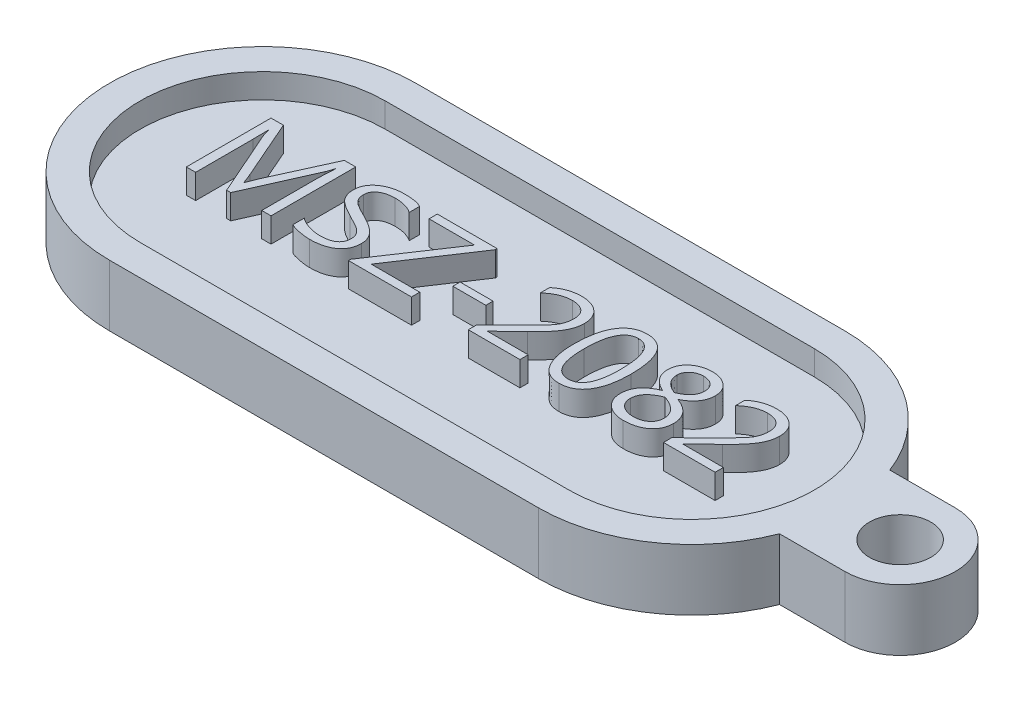
from build123d import *

# Parameters (mm, degrees)
EXTRUDE_1_DEPTH     = 5
CUT_EXTRUDE_1_DEPTH = 2
SKETCH_3_W          = 2.695980479
SKETCH_3_H          = 0.58974573
EXTRUDE_2_DEPTH     = 2
EXTRUDE_START       = -5
EXTRUDE_3_DEPTH     = 5
SKETCH_5_R          = 2.5
CUT_EXTRUDE_2_DEPTH = 59.081838814


with BuildPart() as part:
    # 草圖1 → 填料-伸長1 (new body)
    with BuildSketch(Plane(origin=(0, 0, 0), x_dir=(1, 0, 0), z_dir=(0, 1, 0))):
        with BuildLine():
            Line((0, 12.5), (35, 12.5))
            ThreePointArc((35, 12.5), (47.5, 0), (35, -12.5))
            Line((35, -12.5), (0, -12.5))
            ThreePointArc((0, -12.5), (-12.5, 0), (0, 12.5))
        make_face()
    extrude(amount=EXTRUDE_1_DEPTH)

    # 草圖2 → 除料-伸長1 (cut)
    with BuildSketch(Plane(origin=(0, 5, 0), x_dir=(1, 0, 0), z_dir=(0, 1, 0))):
        with BuildLine():
            Line((0, -10), (35, -10))
            ThreePointArc((35, -10), (45, 0), (35, 10))
            Line((35, 10), (0, 10))
            ThreePointArc((0, 10), (-10, 0), (0, -10))
        make_face()
    extrude(amount=-CUT_EXTRUDE_1_DEPTH, mode=Mode.SUBTRACT)

    # 草圖3 → 填料-伸長2 (add)
    # profile 1 of 8: a face of its own
    with BuildSketch(Plane(origin=(0, 3, 0), x_dir=(1, 0, 0), z_dir=(0, 1, 0))):
        with BuildLine():
            Line((2.704832855, -2.780069862), (2.704832855, 1.872076141))
            add(Edge.make_bspline(
                [(2.704832855, 1.872076141), (2.705451639, 1.965999263), (2.706765046, 2.165356947), (2.723785134, 2.480790019), (2.743165459, 2.830305206), (2.764660012, 3.073997432), (2.775918278, 3.201636826)],
                knots=[0, 0, 0, 0, 0.846147317, 1.796000454, 2.84560467, 4, 4, 4, 4], degree=3))
            Line((2.775918278, 3.201636826), (2.753539533, 3.201636826))
            add(Edge.make_bspline(
                [(2.753539533, 3.201636826), (2.743548192, 3.162557397), (2.724433888, 3.087795049), (2.695364265, 2.980746478), (2.667741197, 2.884326632), (2.643027552, 2.797522421), (2.61821862, 2.721623614), (2.594038471, 2.656147594), (2.574112113, 2.59996911), (2.558103903, 2.567457612), (2.550814439, 2.552653244)],
                knots=[0, 0, 0, 0, 1.421882079, 2.720184076, 3.910017078, 4.957512784, 5.901570106, 6.723562071, 7.418763907, 8, 8, 8, 8], degree=3))
            Line((2.550814439, 2.552653244), (0.177351155, -2.780069862))
            Line((0.177351155, -2.780069862), (-0.159646405, -2.780069862))
            Line((-0.159646405, -2.780069862), (-2.49230139, 2.517110533))
            add(Edge.make_bspline(
                [(-2.49230139, 2.517110533), (-2.50825019, 2.557274827), (-2.54418821, 2.647778515), (-2.588979084, 2.803459806), (-2.640055609, 2.990926929), (-2.670624846, 3.127763543), (-2.687128104, 3.201636826)],
                knots=[0, 0, 0, 0, 0.727425743, 1.639135316, 2.725452061, 4, 4, 4, 4], degree=3))
            Line((-2.687128104, 3.201636826), (-2.709506848, 3.201636826))
            add(Edge.make_bspline(
                [(-2.709506848, 3.201636826), (-2.707602274, 3.168294632), (-2.703444151, 3.095500933), (-2.700155861, 2.976973523), (-2.696102588, 2.840074234), (-2.691929763, 2.684750326), (-2.689389282, 2.510974986), (-2.688549315, 2.318772944), (-2.686721628, 2.108152676), (-2.686988879, 1.961591581), (-2.687128104, 1.885240108)],
                knots=[0, 0, 0, 0, 0.60868432, 1.328898202, 2.161029372, 3.105090589, 4.160939104, 5.328664916, 6.608359414, 8, 8, 8, 8], degree=3))
            Line((-2.687128104, 1.885240108), (-2.687128104, -2.780069862))
            Line((-2.687128104, -2.780069862), (-3.445372614, -2.780069862))
            Line((-3.445372614, -2.780069862), (-3.445372614, 4.128380116))
            Line((-3.445372614, 4.128380116), (-2.434379934, 4.128380116))
            Line((-2.434379934, 4.128380116), (-0.325512391, -0.705428634))
            add(Edge.make_bspline(
                [(-0.325512391, -0.705428634), (-0.305626123, -0.751443296), (-0.267635571, -0.839349306), (-0.215081222, -0.967013978), (-0.166046613, -1.083239568), (-0.123799868, -1.189851588), (-0.088451579, -1.286199501), (-0.057725404, -1.372060849), (-0.032974569, -1.447644981), (-0.018717188, -1.49480479), (-0.012209972, -1.516329012)],
                knots=[0, 0, 0, 0, 1.38306647, 2.642198107, 3.809130388, 4.863555133, 5.805883861, 6.640654924, 7.379580902, 8, 8, 8, 8], degree=3))
            Line((-0.012209972, -1.516329012), (0.018067152, -1.516329012))
            add(Edge.make_bspline(
                [(0.018067152, -1.516329012), (0.041750654, -1.454015814), (0.090997837, -1.324442509), (0.167894714, -1.122814833), (0.255854295, -0.90795433), (0.31686144, -0.759827269), (0.348482729, -0.68304989)],
                knots=[0, 0, 0, 0, 0.892353374, 1.855548705, 2.888485675, 4, 4, 4, 4], degree=3))
            Line((0.348482729, -0.68304989), (2.536334075, 4.128380116))
            Line((2.536334075, 4.128380116), (3.463077365, 4.128380116))
            Line((3.463077365, 4.128380116), (3.463077365, -2.780069862))
            Line((3.463077365, -2.780069862), (2.704832855, -2.780069862))
        make_face()
    # profile 2 of 8: a face of its own
    with BuildSketch(Plane(origin=(0, 3, 0), x_dir=(1, 0, 0), z_dir=(0, 1, 0))):
        with BuildLine():
            add(Edge.make_bspline(
                [(4.979566384, -1.579516055), (5.032529554, -1.622614836), (5.143704009, -1.713083054), (5.340299648, -1.826436339), (5.568212806, -1.927895513), (5.82030915, -2.019113408), (6.083293989, -2.092848961), (6.342422878, -2.149347552), (6.591641344, -2.184030963), (6.754845512, -2.188262331), (6.83436936, -2.190324132)],
                knots=[0, 0, 0, 0, 0.824008304, 1.729667534, 2.73099571, 3.836262011, 4.96582997, 6.028606668, 7.039406984, 8, 8, 8, 8], degree=3))
            add(Edge.make_bspline(
                [(6.83436936, -2.190324132), (6.8953909, -2.189736529), (7.014075834, -2.188593659), (7.185860868, -2.174930974), (7.34646827, -2.1545396), (7.494693104, -2.124420276), (7.63119688, -2.086376829), (7.756059827, -2.040272332), (7.869680253, -1.985803524), (7.970413396, -1.920068697), (8.060705221, -1.848408541), (8.137990557, -1.766435703), (8.204437369, -1.677224159), (8.257099116, -1.577847814), (8.299967064, -1.471321333), (8.327856885, -1.355075861), (8.347494037, -1.231340197), (8.348847672, -1.145627891), (8.349541983, -1.101664046)],
                knots=[0, 0, 0, 0, 1.378837507, 2.68179467, 3.892243878, 5.035886482, 6.097092991, 7.091851668, 8.041023624, 8.937820652, 9.805180856, 10.639951348, 11.47701622, 12.311256343, 13.174980277, 14.064951597, 15.007468453, 16, 16, 16, 16], degree=3))
            add(Edge.make_bspline(
                [(8.349541983, -1.101664046), (8.348093889, -1.051898187), (8.345245954, -0.954024745), (8.313174955, -0.812398618), (8.264962354, -0.678140873), (8.193463361, -0.554555557), (8.107376005, -0.438762487), (8.008448371, -0.329804331), (7.894061136, -0.2312081), (7.786942106, -0.154622415), (7.688066517, -0.092639499), (7.596566821, -0.038568932), (7.48934593, 0.02260629), (7.366153603, 0.092088426), (7.225910995, 0.165844897), (7.069790077, 0.24806949), (6.8979, 0.337387804), (6.777374214, 0.398684578), (6.714577259, 0.430621734)],
                knots=[0, 0, 0, 0, 1.005537763, 1.977569412, 2.924568116, 3.882992817, 4.854659216, 5.841629658, 6.855098546, 7.905112895, 8.503876225, 9.216726976, 10.056161678, 11.002493774, 12.079249954, 13.263129519, 14.574021882, 16, 16, 16, 16], degree=3))
            add(Edge.make_bspline(
                [(6.714577259, 0.430621734), (6.624404727, 0.477154951), (6.451324248, 0.566472523), (6.206148463, 0.701428522), (5.987686618, 0.833061597), (5.794518411, 0.958840712), (5.627856305, 1.0813846), (5.486644714, 1.19917131), (5.370835322, 1.312019266), (5.279436364, 1.422516105), (5.209206356, 1.53439335), (5.146270458, 1.645634348), (5.095540149, 1.762011205), (5.052794116, 1.881083006), (5.020239504, 2.003556386), (4.995887032, 2.129266529), (4.983241338, 2.258838814), (4.980801841, 2.346394722), (4.979566384, 2.390736448)],
                knots=[0, 0, 0, 0, 1.748414335, 3.355970886, 4.821224117, 6.142369616, 7.326440033, 8.383586825, 9.308522186, 10.10915601, 10.847379431, 11.58175963, 12.309532287, 13.031745884, 13.759871933, 14.490936277, 15.235751281, 16, 16, 16, 16], degree=3))
            add(Edge.make_bspline(
                [(4.979566384, 2.390736448), (4.981492437, 2.458438391), (4.98525418, 2.590665947), (5.017610799, 2.78395067), (5.071589438, 2.966553738), (5.147453903, 3.138648115), (5.242685038, 3.301187095), (5.361173043, 3.452262327), (5.501855437, 3.591523804), (5.660955551, 3.72050301), (5.836951348, 3.834770409), (6.024404218, 3.937188104), (6.223819828, 4.022451121), (6.43386433, 4.092315817), (6.6544515, 4.14633827), (6.88601506, 4.183796092), (7.128273935, 4.208402471), (7.293729819, 4.211202629), (7.378041205, 4.212629506)],
                knots=[0, 0, 0, 0, 0.964116894, 1.883000909, 2.78306003, 3.670523563, 4.556201476, 5.460420138, 6.397646791, 7.37114434, 8.37342726, 9.383344475, 10.411158771, 11.459010025, 12.534111432, 13.643144605, 14.799016748, 16, 16, 16, 16], degree=3))
            add(Edge.make_bspline(
                [(7.378041205, 4.212629506), (7.46187515, 4.212082158), (7.623074272, 4.211029696), (7.855341934, 4.197200022), (8.06859056, 4.177384096), (8.262732866, 4.146768899), (8.438622117, 4.109692963), (8.595170777, 4.062199766), (8.734342094, 4.008426389), (8.816035149, 3.961312728), (8.855038323, 3.938818989)],
                knots=[0, 0, 0, 0, 1.324287661, 2.546391074, 3.674934663, 4.706423643, 5.650121807, 6.512024037, 7.289587278, 8, 8, 8, 8], degree=3))
            Line((8.855038323, 3.938818989), (8.855038323, 3.096325089))
            add(Edge.make_bspline(
                [(8.855038323, 3.096325089), (8.802192473, 3.132132287), (8.695681601, 3.204301735), (8.521720143, 3.292502618), (8.338573241, 3.36968517), (8.143606497, 3.431119246), (7.937820139, 3.480273742), (7.720275184, 3.51337726), (7.491709605, 3.535500154), (7.335532909, 3.537573462), (7.25561631, 3.538634386)],
                knots=[0, 0, 0, 0, 0.907651851, 1.829373358, 2.769941643, 3.733712044, 4.734932567, 5.778044283, 6.863011283, 8, 8, 8, 8], degree=3))
            add(Edge.make_bspline(
                [(7.25561631, 3.538634386), (7.20118107, 3.537981932), (7.094336769, 3.536701308), (6.938185969, 3.523580713), (6.789717894, 3.500758913), (6.648735783, 3.471128534), (6.515234051, 3.431760151), (6.389766829, 3.38234173), (6.271014377, 3.326638051), (6.161720044, 3.260760537), (6.063037752, 3.187052895), (5.974939234, 3.10726599), (5.902131557, 3.018040449), (5.842635602, 2.922221739), (5.793913712, 2.820279514), (5.761821173, 2.709990375), (5.741252112, 2.592916607), (5.738978069, 2.512375258), (5.737810894, 2.471036648)],
                knots=[0, 0, 0, 0, 1.255838427, 2.464932264, 3.611894489, 4.71998994, 5.786748334, 6.818978088, 7.828869626, 8.809927634, 9.757607944, 10.667542292, 11.545190788, 12.404842496, 13.265447651, 14.143096147, 15.046926519, 16, 16, 16, 16], degree=3))
            add(Edge.make_bspline(
                [(5.737810894, 2.471036648), (5.739413578, 2.420421022), (5.742533096, 2.321901081), (5.771680582, 2.179549584), (5.815330001, 2.046095125), (5.881491565, 1.924203687), (5.96287461, 1.81258058), (6.055288078, 1.706880391), (6.163319811, 1.611861546), (6.262523378, 1.534871066), (6.357002859, 1.476929201), (6.442546398, 1.425567262), (6.542594865, 1.367253469), (6.65811948, 1.305040244), (6.788195945, 1.235665762), (6.933290897, 1.161610943), (7.093408441, 1.080778861), (7.205112148, 1.025548603), (7.263514691, 0.996672323)],
                knots=[0, 0, 0, 0, 1.075811074, 2.093994519, 3.080249834, 4.053557108, 5.030485713, 6.016077761, 7.034261206, 8.087548715, 8.683401521, 9.39121351, 10.211222501, 11.147220493, 12.183146766, 13.348290249, 14.613594874, 16, 16, 16, 16], degree=3))
            add(Edge.make_bspline(
                [(7.263514691, 0.996672323), (7.345858779, 0.955986372), (7.505665184, 0.877026538), (7.732868637, 0.753224487), (7.941831784, 0.630941749), (8.131151726, 0.508865866), (8.301474294, 0.3880156), (8.452473554, 0.267900771), (8.584950455, 0.148760048), (8.697478, 0.027639412), (8.795471277, -0.093301033), (8.878472756, -0.217922352), (8.95017933, -0.345010314), (9.007247569, -0.477158678), (9.05131113, -0.612162021), (9.085701398, -0.750485317), (9.103533036, -0.892762324), (9.106363462, -0.9888509), (9.107786493, -1.037160607)],
                knots=[0, 0, 0, 0, 1.5164989, 2.943092106, 4.271507486, 5.513568999, 6.661617855, 7.718521642, 8.698192595, 9.600449361, 10.445746346, 11.265663643, 12.070066717, 12.852132382, 13.63804855, 14.413067372, 15.202150218, 16, 16, 16, 16], degree=3))
            add(Edge.make_bspline(
                [(9.107786493, -1.037160607), (9.105622796, -1.10790009), (9.101397611, -1.246037428), (9.072538898, -1.447544311), (9.022771667, -1.636262192), (8.952211938, -1.812813146), (8.860967611, -1.976080134), (8.75063945, -2.128214232), (8.619461528, -2.266879619), (8.468373418, -2.39148318), (8.301022546, -2.504423796), (8.115281538, -2.599025264), (7.915987753, -2.683935488), (7.698572844, -2.747712096), (7.46670081, -2.801347199), (7.21789451, -2.837043763), (6.953710767, -2.85981062), (6.772109876, -2.862791481), (6.679034548, -2.864319252)],
                knots=[0, 0, 0, 0, 0.987904774, 1.929142407, 2.835931655, 3.707665413, 4.577328643, 5.441533139, 6.325949271, 7.235385481, 8.171942798, 9.13956573, 10.142281647, 11.193027883, 12.299148792, 13.464014025, 14.700239157, 16, 16, 16, 16], degree=3))
            add(Edge.make_bspline(
                [(6.679034548, -2.864319252), (6.616241925, -2.862898201), (6.481615964, -2.859851499), (6.266541413, -2.837855959), (6.024868524, -2.806958293), (5.810024262, -2.769730976), (5.634927184, -2.733678136), (5.509887844, -2.706723302), (5.396504576, -2.676042921), (5.292469496, -2.646256849), (5.199339084, -2.613545113), (5.116675036, -2.578965194), (5.042973668, -2.545920609), (4.999941452, -2.519003952), (4.979566384, -2.506259345)],
                knots=[0, 0, 0, 0, 1.290968854, 2.767807986, 4.441962506, 6.300500317, 7.248909072, 8.117905904, 8.929807324, 9.663499143, 10.342628806, 10.957532744, 11.506408385, 12, 12, 12, 12], degree=3))
            Line((4.979566384, -2.506259345), (4.979566384, -1.579516055))
        make_face()
    # profile 3 of 8: a face of its own
    with BuildSketch(Plane(origin=(0, 3, 0), x_dir=(1, 0, 0), z_dir=(0, 1, 0))):
        Polygon((15.005243792, 3.98226008), (10.961273073, -2.106074742), (14.920994402, -2.106074742), (14.920994402, -2.780069862), (9.781781613, -2.780069862), (9.781781613, -2.598407115), (13.825752332, 3.454384996), (10.118779173, 3.454384996), (10.118779173, 4.128380116), (15.005243792, 4.128380116), align=None)
    # profile 4 of 8: a face of its own
    with BuildSketch(Plane(origin=(0, 3, 0), x_dir=(1, 0, 0), z_dir=(0, 1, 0))):
        with Locations((17.195727932, -0.041964688)):
            Rectangle(SKETCH_3_W, SKETCH_3_H)
    # profile 5 of 8: a face of its own
    with BuildSketch(Plane(origin=(0, 3, 0), x_dir=(1, 0, 0), z_dir=(0, 1, 0))):
        with BuildLine():
            Line((23.76718035, -2.780069862), (19.554710851, -2.780069862))
            Line((19.554710851, -2.780069862), (19.554710851, -2.110023932))
            Line((19.554710851, -2.110023932), (21.605656938, -0.094620557))
            add(Edge.make_bspline(
                [(21.605656938, -0.094620557), (21.686650801, -0.015013784), (21.841780258, 0.137458945), (22.059749505, 0.359650135), (22.254564763, 0.563445525), (22.422840921, 0.751980623), (22.568212773, 0.92241582), (22.688645285, 1.076220171), (22.784367584, 1.213162813), (22.879383086, 1.371901768), (22.965221865, 1.565147562), (23.040369568, 1.799746883), (23.084788121, 2.041965797), (23.090379345, 2.205826226), (23.09318523, 2.288057504)],
                knots=[0, 0, 0, 0, 1.411765122, 2.70398703, 3.869277369, 4.916185139, 5.845127731, 6.653674052, 7.343675287, 7.920894417, 8.951112707, 9.963808528, 10.978163149, 12, 12, 12, 12], degree=3))
            add(Edge.make_bspline(
                [(23.09318523, 2.288057504), (23.092370477, 2.336823407), (23.090786911, 2.431605592), (23.072862136, 2.569408405), (23.045746777, 2.698608056), (23.007534727, 2.819706721), (22.957636182, 2.932154754), (22.895317678, 3.035326366), (22.82210808, 3.129565258), (22.738951683, 3.215502001), (22.645182384, 3.292476633), (22.540166616, 3.357793234), (22.427023846, 3.415288814), (22.303242007, 3.459297336), (22.170768317, 3.494942519), (22.028701144, 3.521554285), (21.876234142, 3.535386405), (21.771547949, 3.537529153), (21.717550659, 3.538634386)],
                knots=[0, 0, 0, 0, 1.104871176, 2.147445181, 3.144414588, 4.094476473, 5.020647867, 5.926511228, 6.819890702, 7.72033083, 8.632290684, 9.562300263, 10.518745963, 11.50373333, 12.534087384, 13.626665571, 14.775830654, 16, 16, 16, 16], degree=3))
            add(Edge.make_bspline(
                [(21.717550659, 3.538634386), (21.638412843, 3.536512034), (21.480586792, 3.532279386), (21.24564981, 3.493074614), (21.012657791, 3.432807866), (20.782290309, 3.346568965), (20.554107054, 3.236280871), (20.329262586, 3.101042653), (20.105283176, 2.943128668), (19.964010117, 2.821549936), (19.891708411, 2.759327529)],
                knots=[0, 0, 0, 0, 0.934619886, 1.863930209, 2.807299706, 3.775403034, 4.76579262, 5.798350803, 6.87322469, 8, 8, 8, 8], degree=3))
            Line((19.891708411, 2.759327529), (19.891708411, 3.517572039))
            add(Edge.make_bspline(
                [(19.891708411, 3.517572039), (19.960940467, 3.573311894), (20.097718985, 3.683434504), (20.31836265, 3.824217939), (20.546421675, 3.94517881), (20.784801499, 4.042441091), (21.031707189, 4.11965069), (21.28794064, 4.172621956), (21.552493284, 4.207204834), (21.73192016, 4.210804846), (21.822862396, 4.212629506)],
                knots=[0, 0, 0, 0, 1.01670306, 2.008652397, 2.990440735, 3.967928667, 4.951295949, 5.947204672, 6.959543833, 8, 8, 8, 8], degree=3))
            add(Edge.make_bspline(
                [(21.822862396, 4.212629506), (21.897503724, 4.211009867), (22.043619906, 4.207839299), (22.257381659, 4.186083102), (22.459686981, 4.145897079), (22.650582956, 4.092534613), (22.830544017, 4.024016167), (22.997687013, 3.937926876), (23.154493062, 3.837324802), (23.298764708, 3.721777044), (23.42930585, 3.593565317), (23.541633004, 3.452294441), (23.63923661, 3.301916684), (23.716571167, 3.138646849), (23.777340507, 2.965220179), (23.821117918, 2.78090312), (23.845683603, 2.585350487), (23.849485549, 2.451357612), (23.85142974, 2.382838068)],
                knots=[0, 0, 0, 0, 1.162027594, 2.274759066, 3.339835413, 4.369195939, 5.357456428, 6.332046714, 7.290851749, 8.253154667, 9.204753754, 10.132917934, 11.057656958, 11.989559249, 12.938014657, 13.913944718, 14.933260018, 16, 16, 16, 16], degree=3))
            add(Edge.make_bspline(
                [(23.85142974, 2.382838068), (23.850507555, 2.328823068), (23.84866599, 2.220957378), (23.830902663, 2.059449623), (23.801345698, 1.898731226), (23.762913362, 1.737614388), (23.708676354, 1.57889548), (23.647655417, 1.419290963), (23.571371835, 1.261929247), (23.485470911, 1.101562574), (23.381644842, 0.937002042), (23.258527206, 0.76378147), (23.116832576, 0.578450321), (22.953626291, 0.383234252), (22.770427719, 0.176611855), (22.566464747, -0.041254981), (22.342687975, -0.270428403), (22.184767866, -0.424495671), (22.103254897, -0.504019936)],
                knots=[0, 0, 0, 0, 0.746636693, 1.491002167, 2.243115636, 3.005340702, 3.778521525, 4.560412919, 5.366412362, 6.194398052, 7.074804574, 8.054452882, 9.132009147, 10.299542075, 11.571734845, 12.949640775, 14.425508696, 16, 16, 16, 16], degree=3))
            Line((22.103254897, -0.504019936), (20.443278636, -2.088961585))
            Line((20.443278636, -2.088961585), (20.443278636, -2.106074742))
            Line((20.443278636, -2.106074742), (23.76718035, -2.106074742))
            Line((23.76718035, -2.106074742), (23.76718035, -2.780069862))
        make_face()
    # profile 6 of 8: a face of its own
    with BuildSketch(Plane(origin=(0, 3, 0), x_dir=(1, 0, 0), z_dir=(0, 1, 0))):
        with BuildLine():
            add(Edge.make_bspline(
                [(24.862422419, 0.534617075), (24.864127009, 0.681215342), (24.867432252, 0.965473249), (24.894660874, 1.378190127), (24.942331555, 1.762988547), (25.00510742, 2.120976566), (25.089805423, 2.450669046), (25.190228957, 2.75425605), (25.310794635, 3.030113736), (25.450892357, 3.27786656), (25.607406477, 3.498168626), (25.782102522, 3.689158138), (25.973134501, 3.851785036), (26.181385274, 3.985118989), (26.407703171, 4.086274271), (26.648822639, 4.160748606), (26.906934373, 4.204802246), (27.084328443, 4.209975587), (27.175331454, 4.212629506)],
                knots=[0, 0, 0, 0, 1.43844369, 2.789180252, 4.055984945, 5.241769879, 6.352926074, 7.393195624, 8.376430728, 9.30197144, 10.181414193, 11.022528892, 11.835168521, 12.636655354, 13.440221335, 14.260128986, 15.107447612, 16, 16, 16, 16], degree=3))
            add(Edge.make_bspline(
                [(27.175331454, 4.212629506), (27.262417524, 4.210532172), (27.431975062, 4.206448639), (27.677480902, 4.162211869), (27.906953135, 4.095280938), (28.118435124, 3.997204123), (28.314619818, 3.874567458), (28.491387962, 3.720590587), (28.653599585, 3.542095967), (28.79611177, 3.333593775), (28.921632679, 3.09885406), (29.031598695, 2.837159631), (29.122474711, 2.547711864), (29.198416445, 2.231490384), (29.257763807, 1.888109745), (29.2962861, 1.517327128), (29.324405528, 1.119526346), (29.326538726, 0.84490298), (29.327640088, 0.703115855)],
                knots=[0, 0, 0, 0, 0.898862189, 1.750094572, 2.569131036, 3.362374315, 4.151043452, 4.95165114, 5.7766394, 6.636891986, 7.553822426, 8.523044581, 9.565463834, 10.684931267, 11.881278751, 13.163042274, 14.535288217, 16, 16, 16, 16], degree=3))
            add(Edge.make_bspline(
                [(29.327640088, 0.703115855), (29.32598538, 0.564844832), (29.322772249, 0.296348511), (29.294719802, -0.094296249), (29.249408317, -0.460943382), (29.185397349, -0.803597261), (29.103217013, -1.122581634), (29.0003945, -1.41643456), (28.880905839, -1.687031423), (28.742686656, -1.932258431), (28.588471003, -2.15287187), (28.412648021, -2.34204152), (28.222885585, -2.504750756), (28.014247906, -2.636526224), (27.789569101, -2.740026096), (27.54709412, -2.812070774), (27.288430084, -2.856612978), (27.110136278, -2.861706515), (27.018680244, -2.864319252)],
                knots=[0, 0, 0, 0, 1.387278349, 2.693833632, 3.927522286, 5.092447297, 6.189220272, 7.229412325, 8.212932029, 9.153365869, 10.050103142, 10.906964784, 11.737949058, 12.551450869, 13.37498306, 14.212115153, 15.082902206, 16, 16, 16, 16], degree=3))
            add(Edge.make_bspline(
                [(27.018680244, -2.864319252), (26.933384602, -2.86148842), (26.76747973, -2.85598229), (26.526224649, -2.81455511), (26.300424599, -2.745163798), (26.090911155, -2.644608144), (25.895546087, -2.519482012), (25.717355333, -2.363999338), (25.55508051, -2.181036927), (25.409137024, -1.970783047), (25.280687973, -1.734922134), (25.167546197, -1.476974937), (25.072935779, -1.195754817), (24.996021523, -0.892870093), (24.935657691, -0.567456468), (24.892645148, -0.220210116), (24.868035991, 0.149872156), (24.864330825, 0.403818117), (24.862422419, 0.534617075)],
                knots=[0, 0, 0, 0, 0.904942331, 1.760164256, 2.589467638, 3.403993361, 4.219117994, 5.044528436, 5.90545026, 6.808533196, 7.754844629, 8.751653261, 9.794360413, 10.900190881, 12.06571242, 13.30477369, 14.611780272, 16, 16, 16, 16], degree=3))
        make_face()
        with BuildLine():
            add(Edge.make_bspline(
                [(25.620666929, 0.578058167), (25.621353571, 0.466133828), (25.622682108, 0.24957907), (25.642037439, -0.064381632), (25.670473809, -0.356450168), (25.708697835, -0.627518852), (25.761877704, -0.87652708), (25.823885983, -1.104859746), (25.898637209, -1.311196522), (25.985449083, -1.495766112), (26.084462894, -1.658490172), (26.193857239, -1.801703065), (26.316839779, -1.921992743), (26.451095747, -2.021344139), (26.597681128, -2.096674171), (26.755356489, -2.151192467), (26.924662398, -2.184938868), (27.041778074, -2.188503128), (27.101613237, -2.190324132)],
                knots=[0, 0, 0, 0, 1.530189453, 2.960659058, 4.299184694, 5.542286654, 6.701406217, 7.778620153, 8.775144913, 9.698385602, 10.562761215, 11.375269099, 12.155961727, 12.907209294, 13.650556378, 14.400076827, 15.182588798, 16, 16, 16, 16], degree=3))
            add(Edge.make_bspline(
                [(27.101613237, -2.190324132), (27.161013646, -2.18852577), (27.276836199, -2.185019212), (27.444938608, -2.151044653), (27.601397859, -2.095586977), (27.74688937, -2.018532563), (27.879960025, -1.918422965), (27.999994349, -1.795377556), (28.110248604, -1.652154481), (28.207116482, -1.48565977), (28.294203758, -1.29862566), (28.366927663, -1.088689298), (28.430297004, -0.857911586), (28.480390522, -0.60477632), (28.521457337, -0.330280131), (28.549623496, -0.033677866), (28.566912333, 0.284730893), (28.568550714, 0.504316381), (28.569395578, 0.617550068)],
                knots=[0, 0, 0, 0, 0.8053877, 1.570394235, 2.3163169, 3.051632411, 3.796055828, 4.566697676, 5.377877398, 6.242967876, 7.175513837, 8.173818669, 9.254504068, 10.421288929, 11.673691452, 13.020043715, 14.463325416, 16, 16, 16, 16], degree=3))
            add(Edge.make_bspline(
                [(28.569395578, 0.617550068), (28.568598176, 0.735612815), (28.567055814, 0.963973662), (28.549213492, 1.295016298), (28.522727409, 1.603474626), (28.483172658, 1.888973157), (28.434127444, 2.152106897), (28.372097963, 2.392077014), (28.300978945, 2.610177103), (28.216321929, 2.804730405), (28.122000746, 2.977586182), (28.015363716, 3.127298564), (27.89723642, 3.254616483), (27.767074576, 3.358144385), (27.62604462, 3.440368855), (27.472663572, 3.4965269), (27.308593359, 3.532098489), (27.195266335, 3.53641898), (27.137155949, 3.538634386)],
                knots=[0, 0, 0, 0, 1.567911033, 3.032705078, 4.401942828, 5.678651997, 6.859383789, 7.954881272, 8.968521451, 9.902915215, 10.768999177, 11.579282787, 12.337955961, 13.067925802, 13.780685892, 14.496228308, 15.228915124, 16, 16, 16, 16], degree=3))
            add(Edge.make_bspline(
                [(27.137155949, 3.538634386), (27.076009474, 3.536324842), (26.956234458, 3.531800858), (26.782539054, 3.497361937), (26.620632567, 3.438562526), (26.470842068, 3.356573381), (26.333916107, 3.250287774), (26.207468154, 3.123272374), (26.095830722, 2.970462315), (25.993797425, 2.796208021), (25.907122928, 2.597038349), (25.828770089, 2.376999829), (25.765720106, 2.133066687), (25.71107082, 1.866991026), (25.672084271, 1.577024057), (25.641044972, 1.264478357), (25.62496602, 0.928825361), (25.622129922, 0.697425245), (25.620666929, 0.578058167)],
                knots=[0, 0, 0, 0, 0.791435419, 1.550280527, 2.281832525, 3.014178443, 3.751729661, 4.519120401, 5.327087259, 6.195374805, 7.128813132, 8.135164154, 9.217066756, 10.388210071, 11.650572926, 13.003505341, 14.454266923, 16, 16, 16, 16], degree=3))
        make_face(mode=Mode.SUBTRACT)
    # profile 7 of 8: a face of its own
    with BuildSketch(Plane(origin=(0, 3, 0), x_dir=(1, 0, 0), z_dir=(0, 1, 0))):
        with BuildLine():
            add(Edge.make_bspline(
                [(31.747177257, 0.857134271), (31.696907189, 0.881664383), (31.598252935, 0.92980436), (31.457508781, 1.008700587), (31.32664163, 1.091911037), (31.205303506, 1.178869617), (31.093092367, 1.269279671), (30.991490713, 1.364730269), (30.898678505, 1.462978832), (30.81760039, 1.566744933), (30.742414523, 1.671737912), (30.679460105, 1.782672894), (30.626686625, 1.897816902), (30.583186567, 2.016675809), (30.548661329, 2.138920253), (30.525198971, 2.265402218), (30.51034589, 2.395648152), (30.508211705, 2.484160249), (30.507131548, 2.528958103)],
                knots=[0, 0, 0, 0, 1.214741453, 2.383911863, 3.502295912, 4.581411601, 5.624836344, 6.629543861, 7.60731012, 8.556941109, 9.487635541, 10.40970135, 11.32231084, 12.235915109, 13.156255356, 14.077779194, 15.027123185, 16, 16, 16, 16], degree=3))
            add(Edge.make_bspline(
                [(30.507131548, 2.528958103), (30.508959974, 2.590043635), (30.512555331, 2.71016026), (30.539162467, 2.885972948), (30.583776909, 3.053086057), (30.647601038, 3.210590442), (30.728336561, 3.359054259), (30.826914361, 3.498562916), (30.943310349, 3.629430304), (31.077366626, 3.749403682), (31.223966363, 3.857798905), (31.380132747, 3.953436645), (31.545505416, 4.033848218), (31.719032925, 4.099810407), (31.901305293, 4.149443796), (32.091207506, 4.187009831), (32.290401019, 4.207503966), (32.42595677, 4.210901677), (32.494890593, 4.212629506)],
                knots=[0, 0, 0, 0, 1.005785716, 1.977744687, 2.920878851, 3.848181544, 4.769835065, 5.698150957, 6.655383246, 7.648050251, 8.655470274, 9.654430667, 10.659593091, 11.679660611, 12.707099598, 13.767236096, 14.864578225, 16, 16, 16, 16], degree=3))
            add(Edge.make_bspline(
                [(32.494890593, 4.212629506), (32.556828141, 4.211542751), (32.67844513, 4.20940886), (32.857117849, 4.187318188), (33.028834952, 4.153362342), (33.19328017, 4.106287874), (33.350344638, 4.045376614), (33.499292188, 3.969639885), (33.642279354, 3.881657643), (33.775435518, 3.779273267), (33.897597064, 3.666964895), (34.005375273, 3.545142629), (34.096558765, 3.414513984), (34.171297761, 3.275056013), (34.227641607, 3.126591385), (34.268495166, 2.969956041), (34.29437125, 2.804944022), (34.297010423, 2.691849354), (34.298354097, 2.634269841)],
                knots=[0, 0, 0, 0, 1.108279727, 2.176153998, 3.217553609, 4.239364205, 5.234218711, 6.228390725, 7.2267434, 8.235395457, 9.230405009, 10.1932683, 11.141180041, 12.075949147, 13.018344318, 13.976711224, 14.969889688, 16, 16, 16, 16], degree=3))
            add(Edge.make_bspline(
                [(34.298354097, 2.634269841), (34.297271253, 2.587280538), (34.295130793, 2.494396688), (34.280297924, 2.357579149), (34.256752249, 2.224574797), (34.222597054, 2.095488213), (34.177478247, 1.970255187), (34.123272026, 1.848878586), (34.060533752, 1.731132362), (33.985482931, 1.619019825), (33.902827192, 1.50963314), (33.810257257, 1.403807052), (33.707199763, 1.302302944), (33.593766876, 1.205199981), (33.471089057, 1.111671952), (33.338936305, 1.021843779), (33.196863998, 0.93635807), (33.097190174, 0.883855597), (33.046460818, 0.857134271)],
                knots=[0, 0, 0, 0, 0.980437376, 1.938032521, 2.868404941, 3.79679266, 4.720699214, 5.642970856, 6.568871717, 7.500909818, 8.45504025, 9.428397014, 10.431992197, 11.470849375, 12.542207219, 13.649508797, 14.803708908, 16, 16, 16, 16], degree=3))
            Line((33.046460818, 0.857134271), (33.046460818, 0.840021114))
            add(Edge.make_bspline(
                [(33.046460818, 0.840021114), (33.107227596, 0.815973937), (33.226414485, 0.768808228), (33.397687003, 0.690707205), (33.555579428, 0.603732458), (33.704632273, 0.515544771), (33.839136978, 0.417215687), (33.964438544, 0.31670167), (34.074955055, 0.207449546), (34.175560979, 0.094560506), (34.264488863, -0.024557278), (34.340943468, -0.149840299), (34.405336968, -0.280985496), (34.460127941, -0.416514045), (34.500917988, -0.558672975), (34.529203075, -0.706756879), (34.548851906, -0.860239329), (34.550347469, -0.964696205), (34.551102267, -1.017414656)],
                knots=[0, 0, 0, 0, 1.223005121, 2.398780699, 3.519496888, 4.595484713, 5.636981747, 6.634829377, 7.598818455, 8.541301109, 9.462690318, 10.376731222, 11.283847614, 12.194229161, 13.109044411, 14.046361164, 15.014015945, 16, 16, 16, 16], degree=3))
            add(Edge.make_bspline(
                [(34.551102267, -1.017414656), (34.549655591, -1.088186062), (34.54681999, -1.226903762), (34.51517214, -1.428378543), (34.467433825, -1.618156134), (34.398027145, -1.795304922), (34.309288194, -1.960280149), (34.20253769, -2.114924463), (34.073043787, -2.254420113), (33.927129558, -2.38213491), (33.764365793, -2.495465236), (33.587565536, -2.593669832), (33.398148224, -2.678994557), (33.195116289, -2.746776409), (32.978832986, -2.79937697), (32.750059279, -2.837267241), (32.507626789, -2.859750805), (32.341798175, -2.862769001), (32.256622787, -2.864319252)],
                knots=[0, 0, 0, 0, 1.02085597, 2.000960574, 2.936659147, 3.84128513, 4.739701633, 5.635949206, 6.546147342, 7.479957, 8.430695099, 9.403463842, 10.395916996, 11.425579516, 12.488777668, 13.606225759, 14.770473661, 16, 16, 16, 16], degree=3))
            add(Edge.make_bspline(
                [(32.256622787, -2.864319252), (32.186802336, -2.86271028), (32.049866901, -2.859554682), (31.848403543, -2.837434524), (31.656156556, -2.797501088), (31.472418359, -2.74366689), (31.297297263, -2.674929443), (31.130947914, -2.590574085), (30.973519075, -2.490035348), (30.827114034, -2.374545918), (30.692490912, -2.247672161), (30.575441902, -2.109232577), (30.474938409, -1.961987775), (30.394895517, -1.80407901), (30.33098169, -1.637490117), (30.286279634, -1.460784582), (30.259840823, -1.274915746), (30.256222333, -1.147823907), (30.254383378, -1.083234492)],
                knots=[0, 0, 0, 0, 1.116270563, 2.189286845, 3.234960785, 4.251662787, 5.246984924, 6.238442488, 7.229030929, 8.228301206, 9.215804314, 10.181459591, 11.121285002, 12.059433088, 13.005365901, 13.968443813, 14.967541685, 16, 16, 16, 16], degree=3))
            add(Edge.make_bspline(
                [(30.254383378, -1.083234492), (30.255126456, -1.02920073), (30.256593022, -0.922557681), (30.276241634, -0.765999638), (30.30488837, -0.614512766), (30.345312374, -0.468524005), (30.398883837, -0.328543782), (30.461243629, -0.193225472), (30.539147384, -0.065092451), (30.626803432, 0.058392545), (30.726369999, 0.1763391), (30.837449868, 0.28837445), (30.959928862, 0.395205248), (31.094999052, 0.495383289), (31.241755998, 0.589382616), (31.398060742, 0.681731796), (31.568728741, 0.763307269), (31.686888096, 0.814103199), (31.747177257, 0.840021114)],
                knots=[0, 0, 0, 0, 0.995408807, 1.964575968, 2.903675851, 3.835853269, 4.752246124, 5.664058417, 6.578199645, 7.51188479, 8.453280848, 9.419879421, 10.417422012, 11.446281575, 12.516439563, 13.629068522, 14.790265337, 16, 16, 16, 16], degree=3))
            Line((31.747177257, 0.840021114), (31.747177257, 0.857134271))
        make_face()
        with BuildLine():
            add(Edge.make_bspline(
                [(33.540109587, 2.515794136), (33.539078066, 2.554895919), (33.537077132, 2.630745166), (33.522138878, 2.741349215), (33.498621512, 2.845389201), (33.466387281, 2.943502942), (33.421741572, 3.033897017), (33.369220471, 3.118424267), (33.306993384, 3.197156907), (33.234041189, 3.26712443), (33.155507371, 3.332699232), (33.068319299, 3.387437452), (32.975505188, 3.433610192), (32.876943703, 3.472286987), (32.771678297, 3.502645245), (32.659603638, 3.522860725), (32.541759219, 3.53692448), (32.461147178, 3.538055205), (32.41985598, 3.538634386)],
                knots=[0, 0, 0, 0, 1.094557922, 2.12321251, 3.11868193, 4.07832796, 5.006957876, 5.934205114, 6.860963857, 7.807942827, 8.759691701, 9.720830855, 10.682362551, 11.658848496, 12.681542804, 13.744193145, 14.844527864, 16, 16, 16, 16], degree=3))
            add(Edge.make_bspline(
                [(32.41985598, 3.538634386), (32.381628599, 3.538112841), (32.305763551, 3.537077796), (32.194460268, 3.521655973), (32.087130812, 3.499284705), (31.983114568, 3.469400347), (31.883690474, 3.427851156), (31.786978665, 3.379815504), (31.695545049, 3.320580924), (31.608296339, 3.254736201), (31.528596501, 3.18149041), (31.457833271, 3.103508735), (31.398286109, 3.019993167), (31.349093253, 2.931875844), (31.312437485, 2.838152953), (31.284197988, 2.740971935), (31.268330109, 2.638300018), (31.266373737, 2.568501867), (31.265376058, 2.532907293)],
                knots=[0, 0, 0, 0, 1.076189717, 2.13577764, 3.158968904, 4.164303896, 5.179020603, 6.190795988, 7.202495841, 8.243457312, 9.267171241, 10.247646999, 11.204774746, 12.150981887, 13.083030517, 14.033990676, 14.997405175, 16, 16, 16, 16], degree=3))
            add(Edge.make_bspline(
                [(31.265376058, 2.532907293), (31.26828164, 2.460130934), (31.274001862, 2.316856078), (31.330915035, 2.11022301), (31.419651314, 1.917165308), (31.547077094, 1.739857721), (31.708021446, 1.575502063), (31.905491498, 1.427202855), (32.136955336, 1.291527635), (32.30790999, 1.218114414), (32.397477236, 1.179651467)],
                knots=[0, 0, 0, 0, 0.92551757, 1.822066907, 2.710188705, 3.620908211, 4.58972261, 5.630966945, 6.75880674, 8, 8, 8, 8], degree=3))
            add(Edge.make_bspline(
                [(32.397477236, 1.179651467), (32.48746799, 1.219510356), (32.660090357, 1.295968607), (32.893309588, 1.43462326), (33.093076539, 1.58327398), (33.255371051, 1.746168854), (33.383427341, 1.920466615), (33.475089424, 2.107777977), (33.529118886, 2.308329297), (33.536419833, 2.446144869), (33.540109587, 2.515794136)],
                knots=[0, 0, 0, 0, 1.261370457, 2.419590272, 3.472016325, 4.447002548, 5.35770888, 6.233633439, 7.107313241, 8, 8, 8, 8], degree=3))
        make_face(mode=Mode.SUBTRACT)
        with BuildLine():
            add(Edge.make_bspline(
                [(32.348770557, 0.481961206), (32.29456104, 0.46013041), (32.188628203, 0.417470037), (32.037507727, 0.345818755), (31.896004604, 0.272527974), (31.765362718, 0.194857898), (31.645083872, 0.112848355), (31.534821033, 0.027989995), (31.435077697, -0.060605456), (31.346704538, -0.153479829), (31.266925651, -0.248843535), (31.200239979, -0.349930485), (31.141440905, -0.452742935), (31.093480445, -0.559658789), (31.058474726, -0.671270248), (31.031891588, -0.785606037), (31.015560137, -0.903735893), (31.013613444, -0.983575899), (31.012627888, -1.02399664)],
                knots=[0, 0, 0, 0, 1.304140665, 2.548469852, 3.731302452, 4.860062963, 5.9385401, 6.978804817, 7.963794188, 8.912823745, 9.838313213, 10.73473897, 11.611855415, 12.480012763, 13.344183146, 14.218506306, 15.098080046, 16, 16, 16, 16], degree=3))
            add(Edge.make_bspline(
                [(31.012627888, -1.02399664), (31.013960477, -1.067937177), (31.016571102, -1.154019427), (31.035049164, -1.279949191), (31.066689993, -1.398660898), (31.110223721, -1.510066036), (31.166071256, -1.614139993), (31.235219795, -1.710852046), (31.317101647, -1.800409251), (31.41059148, -1.881660504), (31.513578447, -1.954088923), (31.624433616, -2.01703778), (31.741746401, -2.071555674), (31.86633678, -2.114535092), (31.996889926, -2.149292163), (32.134430836, -2.172265558), (32.278671092, -2.187250432), (32.377253003, -2.189282929), (32.42775436, -2.190324132)],
                knots=[0, 0, 0, 0, 1.022744442, 2.00362008, 2.955067317, 3.876939014, 4.781847028, 5.697358564, 6.637331527, 7.600170483, 8.575070972, 9.563311958, 10.564246757, 11.581877444, 12.627424081, 13.705545149, 14.824600964, 16, 16, 16, 16], degree=3))
            add(Edge.make_bspline(
                [(32.42775436, -2.190324132), (32.47605945, -2.18924735), (32.571132138, -2.187128058), (32.710159577, -2.172433267), (32.843246225, -2.149059736), (32.969155236, -2.114856583), (33.089098352, -2.071139728), (33.202032583, -2.017488421), (33.308157132, -1.953241664), (33.408194713, -1.881724952), (33.49826567, -1.800917324), (33.576801296, -1.712731847), (33.644789993, -1.619510236), (33.698897533, -1.518254917), (33.741227725, -1.410907315), (33.77170406, -1.297472429), (33.788585361, -1.177641346), (33.791412367, -1.09601013), (33.792857757, -1.054273764)],
                knots=[0, 0, 0, 0, 1.163873482, 2.290702323, 3.365063086, 4.416705746, 5.43029096, 6.437680203, 7.424154064, 8.416109477, 9.396957178, 10.333011525, 11.257347078, 12.170425779, 13.091307672, 14.032602726, 14.994110139, 16, 16, 16, 16], degree=3))
            add(Edge.make_bspline(
                [(33.792857757, -1.054273764), (33.791965517, -1.012090165), (33.790201271, -0.928679657), (33.772518632, -0.805620765), (33.743629705, -0.687089589), (33.703411884, -0.572705727), (33.653579595, -0.461712254), (33.591711781, -0.354699707), (33.516531692, -0.253229948), (33.432874456, -0.153903278), (33.335726274, -0.060267877), (33.227107241, 0.028803181), (33.109143859, 0.116020476), (32.979036378, 0.197661704), (32.837913747, 0.275374382), (32.685158205, 0.348537103), (32.521522383, 0.41890194), (32.407348922, 0.460578459), (32.348770557, 0.481961206)],
                knots=[0, 0, 0, 0, 0.895235095, 1.77016699, 2.633411959, 3.482052105, 4.341062985, 5.213610323, 6.100711398, 7.019349962, 7.96815849, 8.960700425, 10.000569113, 11.081052395, 12.219515879, 13.419674284, 14.676126145, 16, 16, 16, 16], degree=3))
        make_face(mode=Mode.SUBTRACT)
    # profile 8 of 8: a face of its own
    with BuildSketch(Plane(origin=(0, 3, 0), x_dir=(1, 0, 0), z_dir=(0, 1, 0))):
        with BuildLine():
            Line((39.690315056, -2.780069862), (35.477845557, -2.780069862))
            Line((35.477845557, -2.780069862), (35.477845557, -2.110023932))
            Line((35.477845557, -2.110023932), (37.528791644, -0.094620557))
            add(Edge.make_bspline(
                [(37.528791644, -0.094620557), (37.609785507, -0.015013784), (37.764914964, 0.137458945), (37.982884211, 0.359650135), (38.177699469, 0.563445525), (38.345975627, 0.751980623), (38.491347479, 0.92241582), (38.611779991, 1.076220171), (38.70750229, 1.213162813), (38.802517792, 1.371901768), (38.888356571, 1.565147562), (38.963504274, 1.799746883), (39.007922827, 2.041965797), (39.013514051, 2.205826226), (39.016319936, 2.288057504)],
                knots=[0, 0, 0, 0, 1.411765122, 2.70398703, 3.869277369, 4.916185139, 5.845127731, 6.653674052, 7.343675287, 7.920894417, 8.951112707, 9.963808528, 10.978163149, 12, 12, 12, 12], degree=3))
            add(Edge.make_bspline(
                [(39.016319936, 2.288057504), (39.015505183, 2.336823407), (39.013921617, 2.431605592), (38.995996842, 2.569408405), (38.968881483, 2.698608056), (38.930669433, 2.819706721), (38.880770888, 2.932154754), (38.818452384, 3.035326366), (38.745242787, 3.129565258), (38.662086389, 3.215502001), (38.56831709, 3.292476633), (38.463301323, 3.357793234), (38.350158552, 3.415288814), (38.226376713, 3.459297336), (38.093903023, 3.494942519), (37.95183585, 3.521554285), (37.799368848, 3.535386405), (37.694682655, 3.537529153), (37.640685365, 3.538634386)],
                knots=[0, 0, 0, 0, 1.104871176, 2.147445181, 3.144414588, 4.094476473, 5.020647867, 5.926511228, 6.819890702, 7.72033083, 8.632290684, 9.562300263, 10.518745963, 11.50373333, 12.534087384, 13.626665571, 14.775830654, 16, 16, 16, 16], degree=3))
            add(Edge.make_bspline(
                [(37.640685365, 3.538634386), (37.561547549, 3.536512034), (37.403721498, 3.532279386), (37.168784516, 3.493074614), (36.935792498, 3.432807866), (36.705425015, 3.346568965), (36.47724176, 3.236280871), (36.252397292, 3.101042653), (36.028417882, 2.943128668), (35.887144823, 2.821549936), (35.814843117, 2.759327529)],
                knots=[0, 0, 0, 0, 0.934619886, 1.863930209, 2.807299706, 3.775403034, 4.76579262, 5.798350803, 6.87322469, 8, 8, 8, 8], degree=3))
            Line((35.814843117, 2.759327529), (35.814843117, 3.517572039))
            add(Edge.make_bspline(
                [(35.814843117, 3.517572039), (35.884075174, 3.573311894), (36.020853691, 3.683434504), (36.241497356, 3.824217939), (36.469556382, 3.94517881), (36.707936205, 4.042441091), (36.954841895, 4.11965069), (37.211075346, 4.172621956), (37.47562799, 4.207204834), (37.655054866, 4.210804846), (37.745997103, 4.212629506)],
                knots=[0, 0, 0, 0, 1.01670306, 2.008652397, 2.990440735, 3.967928667, 4.951295949, 5.947204672, 6.959543833, 8, 8, 8, 8], degree=3))
            add(Edge.make_bspline(
                [(37.745997103, 4.212629506), (37.82063843, 4.211009867), (37.966754612, 4.207839299), (38.180516365, 4.186083102), (38.382821687, 4.145897079), (38.573717662, 4.092534613), (38.753678723, 4.024016167), (38.920821719, 3.937926876), (39.077627768, 3.837324802), (39.221899414, 3.721777044), (39.352440556, 3.593565317), (39.46476771, 3.452294441), (39.562371316, 3.301916684), (39.639705873, 3.138646849), (39.700475213, 2.965220179), (39.744252624, 2.78090312), (39.768818309, 2.585350487), (39.772620255, 2.451357612), (39.774564446, 2.382838068)],
                knots=[0, 0, 0, 0, 1.162027594, 2.274759066, 3.339835413, 4.369195939, 5.357456428, 6.332046714, 7.290851749, 8.253154667, 9.204753754, 10.132917934, 11.057656958, 11.989559249, 12.938014657, 13.913944718, 14.933260018, 16, 16, 16, 16], degree=3))
            add(Edge.make_bspline(
                [(39.774564446, 2.382838068), (39.773642261, 2.328823068), (39.771800696, 2.220957378), (39.754037369, 2.059449623), (39.724480404, 1.898731226), (39.686048068, 1.737614388), (39.63181106, 1.57889548), (39.570790123, 1.419290963), (39.494506541, 1.261929247), (39.408605618, 1.101562574), (39.304779548, 0.937002042), (39.181661912, 0.76378147), (39.039967283, 0.578450321), (38.876760997, 0.383234252), (38.693562425, 0.176611855), (38.489599453, -0.041254981), (38.265822681, -0.270428403), (38.107902573, -0.424495671), (38.026389604, -0.504019936)],
                knots=[0, 0, 0, 0, 0.746636693, 1.491002167, 2.243115636, 3.005340702, 3.778521525, 4.560412919, 5.366412362, 6.194398052, 7.074804574, 8.054452882, 9.132009147, 10.299542075, 11.571734845, 12.949640775, 14.425508696, 16, 16, 16, 16], degree=3))
            Line((38.026389604, -0.504019936), (36.366413342, -2.088961585))
            Line((36.366413342, -2.088961585), (36.366413342, -2.106074742))
            Line((36.366413342, -2.106074742), (39.690315056, -2.106074742))
            Line((39.690315056, -2.106074742), (39.690315056, -2.780069862))
        make_face()
    extrude(amount=EXTRUDE_2_DEPTH)

    # 草圖4 → 填料-伸長3 (add)
    with BuildSketch(Plane(origin=(0, 5, 0), x_dir=(1, 0, 0), z_dir=(0, 1, 0)).offset(EXTRUDE_START)):
        with BuildLine():
            Line((52, 4.5), (46.66190379, 4.5))
            ThreePointArc((46.66190379, 4.5), (47.5, 0), (46.66190379, -4.5))
            Line((46.66190379, -4.5), (52, -4.5))
            ThreePointArc((52, -4.5), (56.5, 0), (52, 4.5))
        make_face()
    extrude(amount=EXTRUDE_3_DEPTH)

    # 草圖5 → 除料-伸長2 (cut, through all)
    with BuildSketch(Plane(origin=(0, 5, 0), x_dir=(1, 0, 0), z_dir=(0, 1, 0))):
        with Locations(Location((52, 0, 0), (0, 0, 270))):
            Circle(SKETCH_5_R)
    extrude(amount=-CUT_EXTRUDE_2_DEPTH, mode=Mode.SUBTRACT)


solid = part.part
